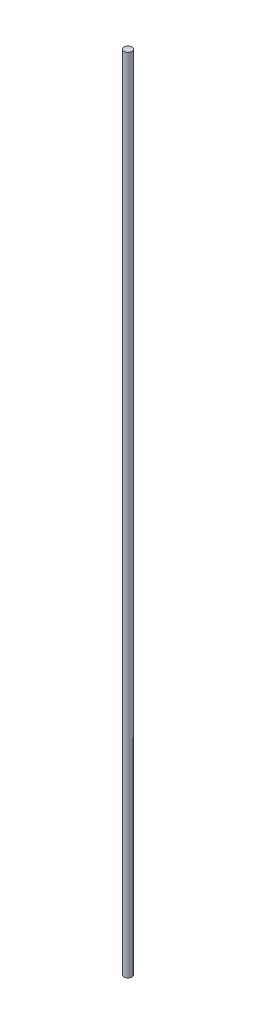
from build123d import *

# Parameters (mm, degrees)
CROQUIS1_R              = 2.1
SALIENTE_EXTRUIR1_DEPTH = 429


with BuildPart() as part:
    # Croquis1 → Saliente-Extruir1 (new body)
    with BuildSketch(Plane(origin=(0, 0, 0), x_dir=(1, 0, 0), z_dir=(0, 1, 0))):
        with Locations(Location((0, 0, 0), (0, 0, 270))):
            Circle(CROQUIS1_R)
    extrude(amount=SALIENTE_EXTRUIR1_DEPTH)


solid = part.part
